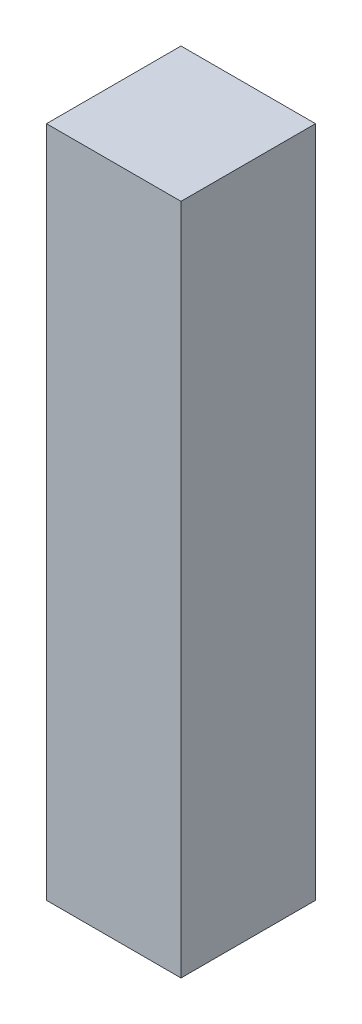
from build123d import *

# Parameters (mm, degrees)
CROQUIS1_W              = 1000
CROQUIS1_H              = 1000
SALIENTE_EXTRUIR1_DEPTH = 5000


with BuildPart() as part:
    # Croquis1 → Saliente-Extruir1 (new body)
    with BuildSketch(Plane(origin=(0, 0, 0), x_dir=(1, 0, 0), z_dir=(0, 1, 0))):
        Rectangle(CROQUIS1_W, CROQUIS1_H)
    extrude(amount=SALIENTE_EXTRUIR1_DEPTH)


solid = part.part
